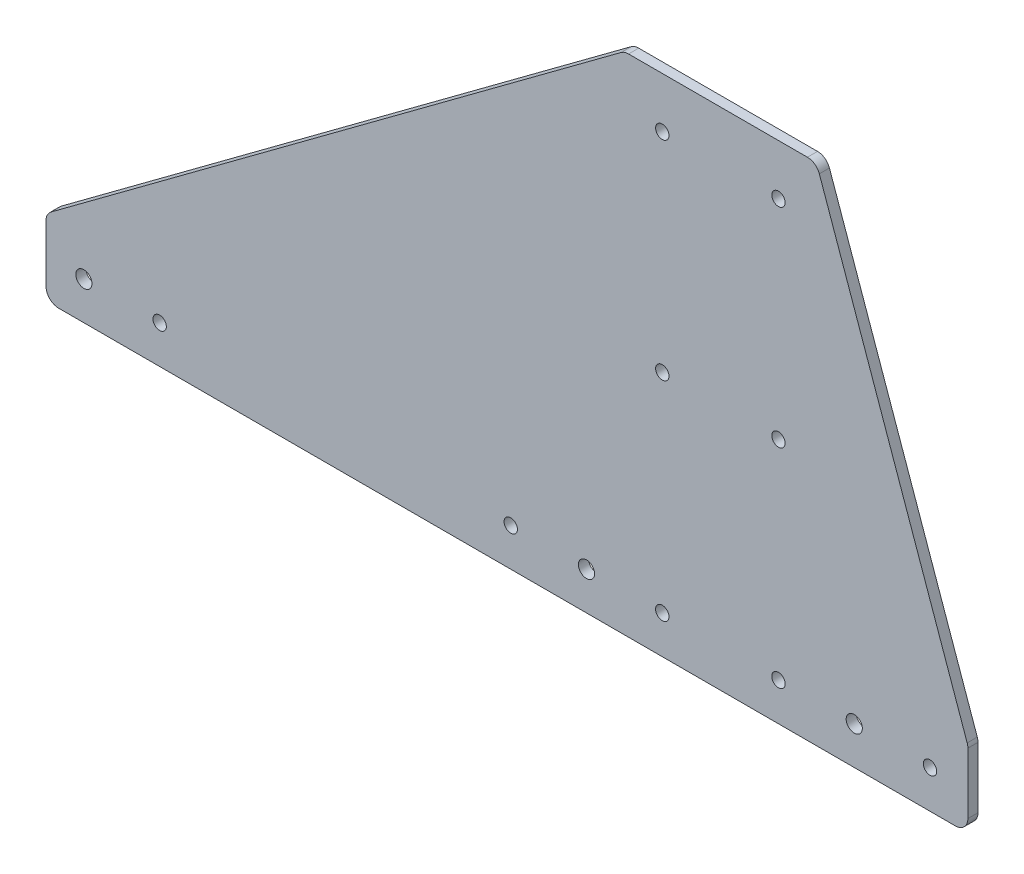
from build123d import *

# Parameters (mm, degrees)
BOSS_EXTRUDE1_DEPTH      = 4
M5_CLEARANCE_HOLE1_D     = 5.3
FILLET1_R                = 5
M6_CLEARANCE_HOLE1_D     = 6.4
M6_CLEARANCE_HOLE1_DEPTH = 8
M6_CLEARANCE_HOLE1_TIP   = 1.922753981


with BuildPart() as part:
    # Sketch1 → Boss-Extrude1 (new body)
    with BuildSketch(Plane.XY):
        Polygon((-267, -30), (98, -30), (98, 0), (38, 170), (-38, 170), (-267, 0), align=None)
    extrude(amount=BOSS_EXTRUDE1_DEPTH)

    # M5 Clearance Hole1 (through all)
    with Locations(Plane.XY.offset(4)):
        with Locations((-23, 150), (-23, 67.5), (-23, -15), (23, -15), (23, 150), (23, 67.5), (-83, -15), (83, -15), (-222, -15)):
            Hole(M5_CLEARANCE_HOLE1_D / 2)

    # Fillet1
    fillet1_edges = [part.edges().sort_by_distance(p)[0] for p in [
        (-267, 0, 2),
        (-38, 170, 2),
        (38, 170, 2),
        (98, 0, 2),
        (98, -30, 2),
        (-267, -30, 2),
    ]]
    fillet(fillet1_edges, radius=FILLET1_R)

    # M6 Clearance Hole1
    with Locations(Plane.XY.offset(4)):
        with Locations((-252, -15), (-53, -15), (53, -15)):
            Hole(M6_CLEARANCE_HOLE1_D / 2, depth=M6_CLEARANCE_HOLE1_DEPTH)
            with Locations((0, 0, -(M6_CLEARANCE_HOLE1_DEPTH + M6_CLEARANCE_HOLE1_TIP / 2))):  # 118° drill point
                Cone(0, M6_CLEARANCE_HOLE1_D / 2, M6_CLEARANCE_HOLE1_TIP, mode=Mode.SUBTRACT)


solid = part.part
